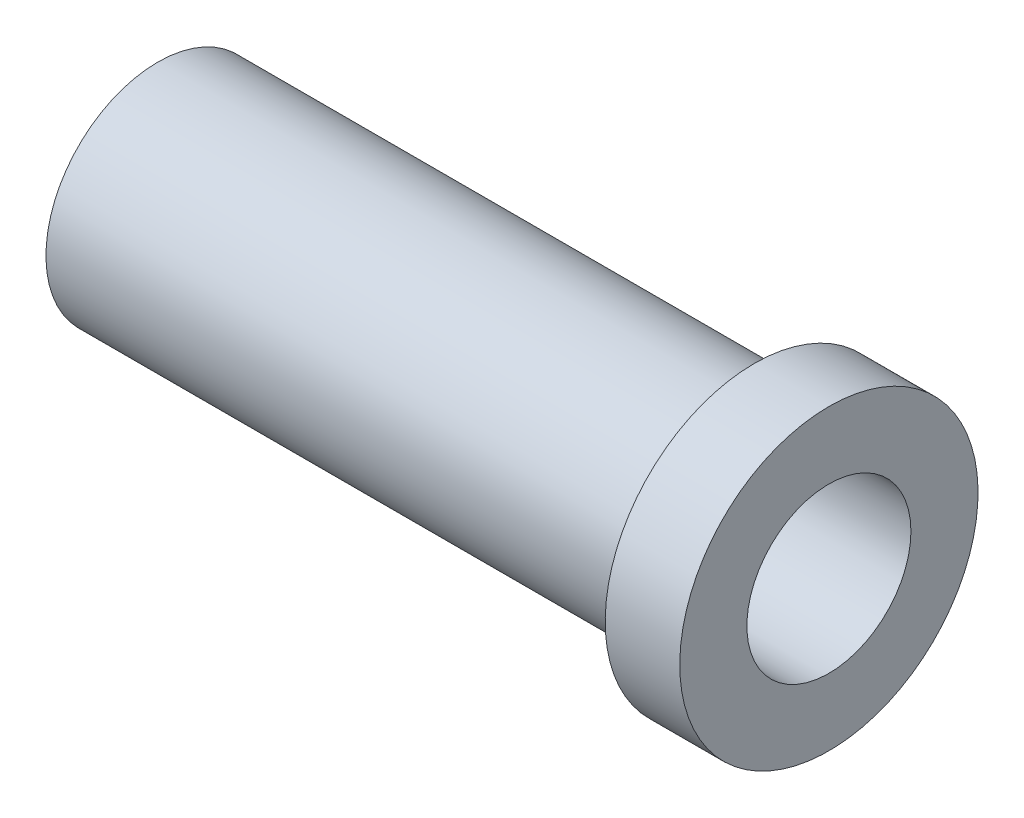
from build123d import *

# Parameters (mm, degrees)
F_1_0MM_DOWEL_HOLE2_D = 11


with BuildPart() as part:
    # Sketch1 → Revolve1 (revolve)
    with BuildSketch(Plane.XY):
        Polygon((0, 0), (0, 7.5), (40, 7.5), (40, 10), (45, 10), (45, 0), align=None)
    revolve(axis=Axis((45, 0, 0), (-1, 0, 0)))

    # Ø1.0mm Dowel Hole2 (through all)
    with Locations(Plane.YZ.offset(45)):
        with Locations((0, 0)):
            Hole(F_1_0MM_DOWEL_HOLE2_D / 2)


solid = part.part
